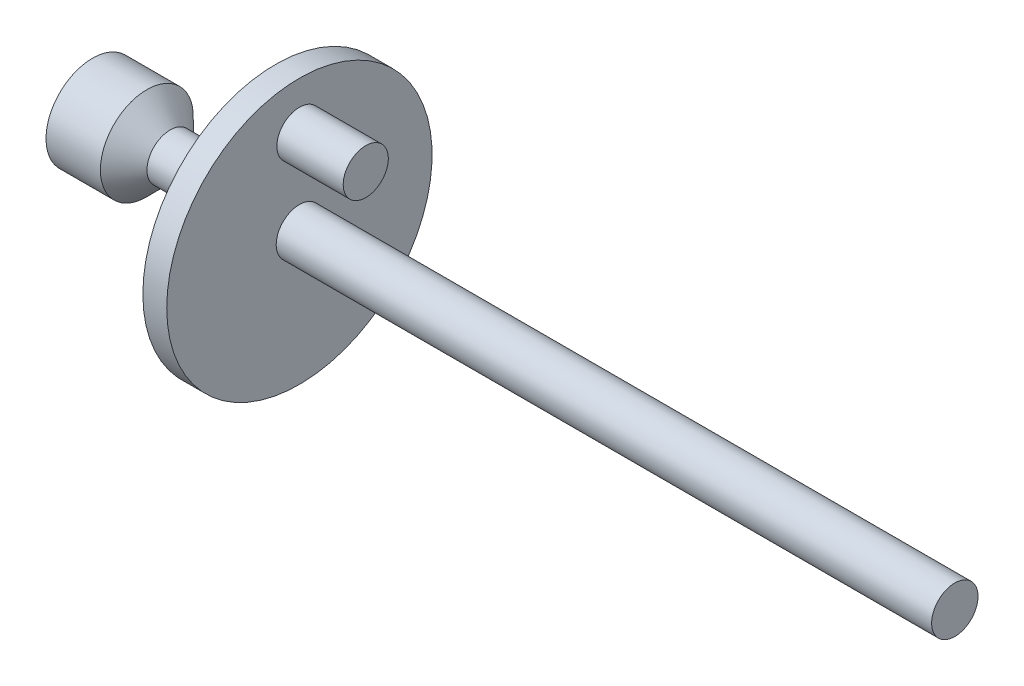
from build123d import *

# Parameters (mm, degrees)
ESQUISSE2_W             = 50
ESQUISSE2_H             = 17
ESQUISSE3_W             = 40
ESQUISSE3_H             = 40
ENL_V_MAT_EXTRU_1_DEPTH = 25
ENL_V_START             = -25
ESQUISSE3_3_W           = 40
ESQUISSE3_3_H           = 40
ENL_V_MAT_EXTRU_2_DEPTH = 25
ENL_V_MAT_EXTRU_2_DRAFT = -20


with BuildPart() as part:
    # Esquisse1 → Révolution1 (revolve)
    with BuildSketch(Plane.XY, mode=Mode.PRIVATE) as r_volution1_sk:
        Polygon((650, 0), (650, 17.5), (156, 17.5), (156, 100), (138, 100), (138, 17.5), (58.6, 17.5), (41, 35), (0, 35), (0, 0), align=None)
    revolve(r_volution1_sk.sketch.rotate(Axis((0, 0, 0), (1, 0, 0)), 90), axis=Axis((0, 0, 0), (1, 0, 0)))

    # Esquisse2 → Révolution2 (revolve)
    with BuildSketch(Plane.XY, mode=Mode.PRIVATE) as r_volution2_sk:
        with Locations((181, 72.5)):
            Rectangle(ESQUISSE2_W, ESQUISSE2_H)
    revolve(r_volution2_sk.sketch.rotate(Axis((156, 64, 0), (1, 0, 0)), 90), axis=Axis((156, 64, 0), (1, 0, 0)))

    # Esquisse3 → Enlèv. mat.-Extru.1 (cut)
    with BuildSketch(Plane.ZY):
        Rectangle(ESQUISSE3_W, ESQUISSE3_H)
    extrude(amount=-ENL_V_MAT_EXTRU_1_DEPTH, mode=Mode.SUBTRACT)


with BuildPart() as enl_v_mat_extru_2_tool:
    # Esquisse3<3> → Enlèv. mat.-Extru.2 (with draft: the straight prism first)
    with BuildSketch(Plane.ZY.offset(ENL_V_START)):
        Rectangle(ESQUISSE3_3_W, ESQUISSE3_3_H)
    extrude(amount=-ENL_V_MAT_EXTRU_2_DEPTH)
    # Enlèv. mat.-Extru.2: the draft: its side faces are tilted about the plane it starts from
    enl_v_mat_extru_2_sides = [enl_v_mat_extru_2_tool.faces().sort_by_distance(p)[0] for p in [
        (37.5, 0, -20),
        (37.5, -20, 0),
        (37.5, 0, 20),
        (37.5, 20, 0),
    ]]
    draft(enl_v_mat_extru_2_sides, Plane.ZY.offset(ENL_V_START), ENL_V_MAT_EXTRU_2_DRAFT)


with BuildPart() as part_1:
    add(part.part)

    # Enlèv. mat.-Extru.2: cut by enl_v_mat_extru_2_tool
    add(enl_v_mat_extru_2_tool.part, mode=Mode.SUBTRACT)


solid = part_1.part
